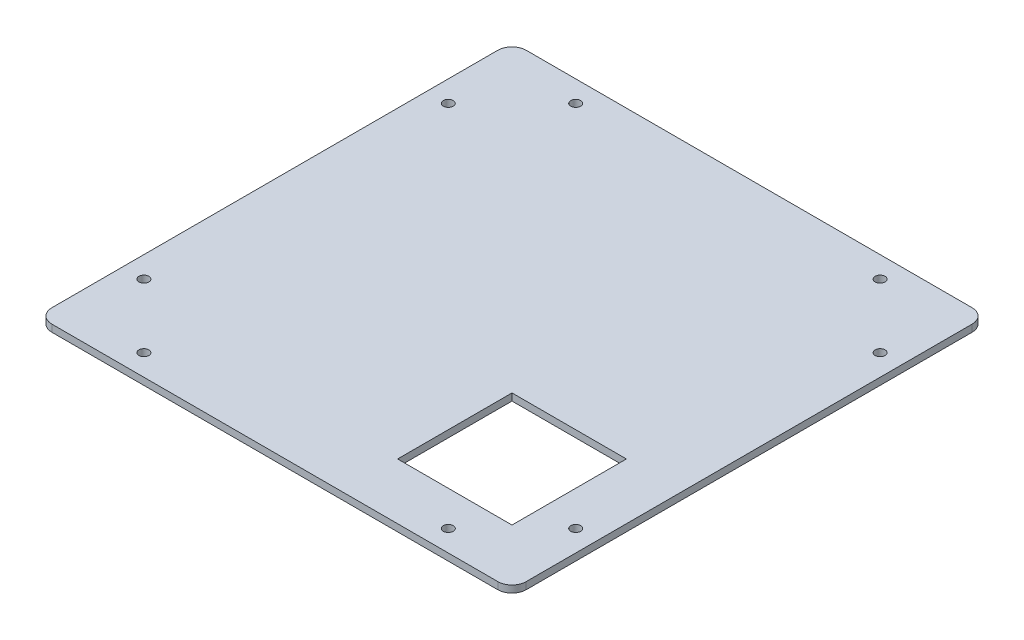
from build123d import *

# Parameters (mm, degrees)
SKETCH1_W           = 425.45
SKETCH1_H           = 425.45
BOSS_EXTRUDE1_DEPTH = 6.35
SKETCH4_R           = 4.445
CUT_EXTRUDE2_DEPTH  = 301.90558943
SKETCH5_W           = 102.616
SKETCH5_H           = 102.616
CUT_EXTRUDE3_DEPTH  = 301.90558943
FILLET1_R           = 12.7


with BuildPart() as part:
    # Sketch1 → Boss-Extrude1 (new body)
    with BuildSketch(Plane(origin=(0, 0, 0), x_dir=(1, 0, 0), z_dir=(0, 1, 0))):
        Rectangle(SKETCH1_W, SKETCH1_H)
    extrude(amount=BOSS_EXTRUDE1_DEPTH)

    # Sketch4 → Cut-Extrude2 (cut, through all)
    with BuildSketch(Plane(origin=(0, 6.35, 0), x_dir=(1, 0, 0), z_dir=(0, 1, 0))):
        with Locations(Location((-193.675, 136.525, 0), (0, 0, 270))):
            Circle(SKETCH4_R)
        with Locations(Location((-193.675, -136.525, 0), (0, 0, 270))):
            Circle(SKETCH4_R)
        with Locations(Location((-136.525, -193.675, 0), (0, 0, 270))):
            Circle(SKETCH4_R)
        with Locations(Location((136.525, -193.675, 0), (0, 0, 270))):
            Circle(SKETCH4_R)
        with Locations(Location((193.675, -136.525, 0), (0, 0, 90))):
            Circle(SKETCH4_R)
        with Locations(Location((193.675, 136.525, 0), (0, 0, 90))):
            Circle(SKETCH4_R)
        with Locations(Location((136.525, 193.675, 0), (0, 0, 90))):
            Circle(SKETCH4_R)
        with Locations(Location((-136.525, 193.675, 0), (0, 0, 90))):
            Circle(SKETCH4_R)
    extrude(amount=-CUT_EXTRUDE2_DEPTH, mode=Mode.SUBTRACT)

    # Sketch5 → Cut-Extrude3 (cut, through all)
    with BuildSketch(Plane(origin=(0, 6.35, 0), x_dir=(1, 0, 0), z_dir=(0, 1, 0))):
        with Locations((111.125, -111.125)):
            Rectangle(SKETCH5_W, SKETCH5_H)
    extrude(amount=-CUT_EXTRUDE3_DEPTH, mode=Mode.SUBTRACT)

    # Fillet1
    fillet1_edges = [part.edges().sort_by_distance(p)[0] for p in [
        (212.725, 3.175, 212.725),
        (-212.725, 3.175, 212.725),
        (-212.725, 3.175, -212.725),
        (212.725, 3.175, -212.725),
    ]]
    fillet(fillet1_edges, radius=FILLET1_R)


solid = part.part
